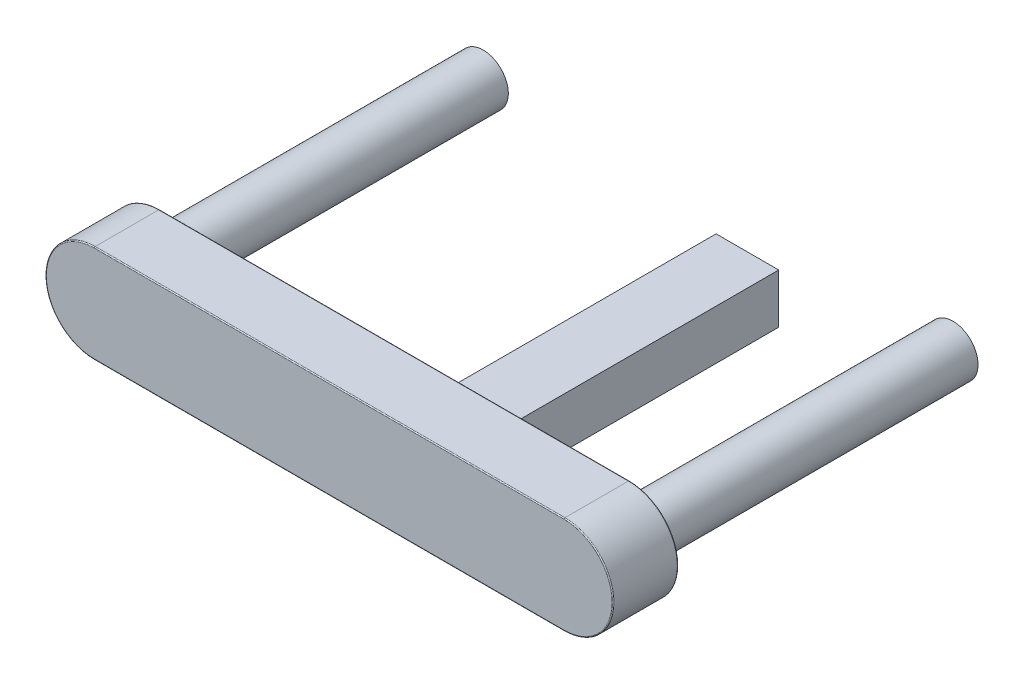
from build123d import *

# Parameters (mm, degrees)
SKETCH1_R           = 4
BOSS_EXTRUDE1_DEPTH = 5
FILLET2_R           = 0.15
SKETCH2_W           = 10
SKETCH2_H           = 7.9994
CUT_EXTRUDE1_DEPTH  = 3
SKETCH3_R           = 1.75
CUT_EXTRUDE2_DEPTH  = 45.69339996
SKETCH4_R           = 4.15
BOSS_EXTRUDE2_DEPTH = 10
SKETCH5_R           = 4.5
BOSS_EXTRUDE3_DEPTH = 0.1
SKETCH6_R           = 3.85
BOSS_EXTRUDE4_DEPTH = 49.5
SKETCH9_W           = 9.6
SKETCH9_H           = 7.5994
BOSS_EXTRUDE5_DEPTH = 53.1
SKETCH10_R          = 1.75
CUT_EXTRUDE3_DEPTH  = 10


with BuildPart() as part:
    # Sketch1 → Boss-Extrude1 (new, symmetric)
    with BuildSketch(Plane.XY):
        with BuildLine():
            Line((-35.999998845, 7.5), (35.999998845, 7.5))
            ThreePointArc((35.999998845, 7.5), (43.5, 0), (35.999998845, -7.5))
            Line((35.999998845, -7.5), (-35.999998845, -7.5))
            ThreePointArc((-35.999998845, -7.5), (-43.5, 0), (-35.999998845, 7.5))
        make_face()
        with Locations((-36, 0)):
            Circle(SKETCH1_R, mode=Mode.SUBTRACT)
        with Locations((36, 0)):
            Circle(SKETCH1_R, mode=Mode.SUBTRACT)
    extrude(amount=BOSS_EXTRUDE1_DEPTH, both=True)

    # Fillet2
    fillet2_edges = [part.edges().sort_by_distance(p)[0] for p in [
        (-40, 0, -5),
        (-40, 0, 5),
        (-43.5, 0, 5),
        (32, 0, -5),
        (32, 0, 5),
        (0, -7.5, 5),
        (43.5, 0, 5),
        (0, -7.5, -5),
        (-43.5, 0, -5),
        (0, 7.5, -5),
        (43.5, 0, -5),
        (0, 7.5, 5),
    ]]
    fillet(fillet2_edges, radius=FILLET2_R)

    # Sketch2 → Cut-Extrude1 (cut)
    with BuildSketch(Plane(origin=(0, 0, -5), x_dir=(-1, 0, 0), z_dir=(0, 0, -1))):
        with Locations((-11, 0.0003)):
            Rectangle(SKETCH2_W, SKETCH2_H)
    extrude(amount=-CUT_EXTRUDE1_DEPTH, mode=Mode.SUBTRACT)

    # Sketch3 → Cut-Extrude2 (cut, through all)
    with BuildSketch(Plane(origin=(0, 0, -2), x_dir=(-1, 0, 0), z_dir=(0, 0, -1))):
        with Locations((-11, 0.0003)):
            Circle(SKETCH3_R)
    extrude(amount=-CUT_EXTRUDE2_DEPTH, mode=Mode.SUBTRACT)

    # Sketch4 → Boss-Extrude2 (add)
    with BuildSketch(Plane.XY.offset(5)):
        with Locations((36, 0)):
            Circle(SKETCH4_R)
        with Locations((-36, 0)):
            Circle(SKETCH4_R)
    extrude(amount=-BOSS_EXTRUDE2_DEPTH)

    # Sketch5 → Boss-Extrude3 (add)
    with BuildSketch(Plane(origin=(0, 0, -5), x_dir=(-1, 0, 0), z_dir=(0, 0, -1))):
        with Locations(Location((36, 0, 0), (0, 0, 180))):
            Circle(SKETCH5_R)
        with Locations(Location((-36, 0, 0), (0, 0, 180))):
            Circle(SKETCH5_R)
    extrude(amount=BOSS_EXTRUDE3_DEPTH)

    # Sketch6 → Boss-Extrude4 (add)
    with BuildSketch(Plane(origin=(0, 0, -5.1), x_dir=(-1, 0, 0), z_dir=(0, 0, -1))):
        with Locations((-36, 0)):
            Circle(SKETCH6_R)
        with Locations((36, 0)):
            Circle(SKETCH6_R)
    extrude(amount=BOSS_EXTRUDE4_DEPTH)

    # Sketch9 → Boss-Extrude5 (add)
    with BuildSketch(Plane.XY.offset(5)):
        with Locations((11, 0.0003)):
            Rectangle(SKETCH9_W, SKETCH9_H)
    extrude(amount=-BOSS_EXTRUDE5_DEPTH)

    # Sketch10 → Cut-Extrude3 (cut)
    with BuildSketch(Plane(origin=(0, 0, -48.1), x_dir=(-1, 0, 0), z_dir=(0, 0, -1))):
        with Locations((-11, 0.0003)):
            Circle(SKETCH10_R)
    extrude(amount=-CUT_EXTRUDE3_DEPTH, mode=Mode.SUBTRACT)


solid = part.part
